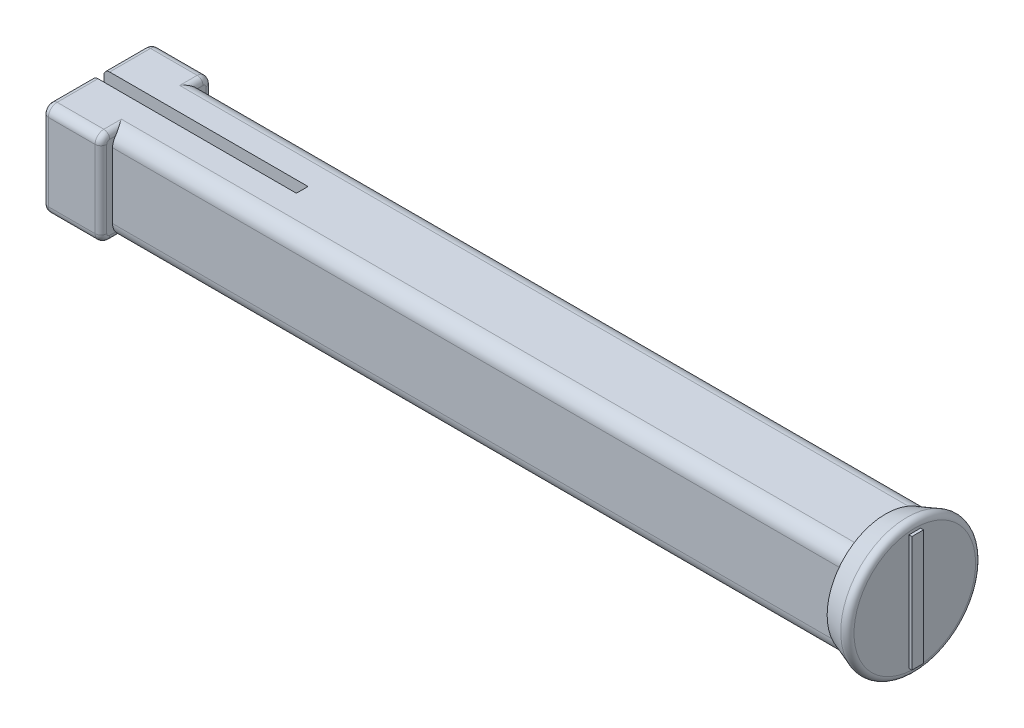
from build123d import *

# Parameters (mm, degrees)
ESQUISSE1_W             = 27
ESQUISSE1_H             = 3.25
BOSS_EXTRU_5_DEPTH      = 3.8
ESQUISSE10_W            = 25
ESQUISSE10_H            = 3.25
ENL_V_MAT_EXTRU_1_DEPTH = 0.4
ESQUISSE12_W            = 25
ESQUISSE12_H            = 3.25
ENL_V_MAT_EXTRU_2_DEPTH = 0.4
ENL_V_MAT_EXTRU_3_DEPTH = 27
ESQUISSE14_W            = 7
ESQUISSE14_H            = 0.4
ENL_V_MAT_EXTRU_4_DEPTH = 21.209927394
CONG_1_R                = 0.5
CONG_2_R                = 0.3
CONG_3_R                = 0.2
ESQUISSE19_R            = 2.005199322
BOSS_EXTRU_8_DEPTH      = 1
D_POUILLE1_ANGLE        = 20
CONG_4_R                = 0.2
ESQUISSE20_W            = 0.4
ESQUISSE20_H            = 3.967080209
BOSS_EXTRU_9_DEPTH      = 0.1


with BuildPart() as part:
    # Esquisse1 → Boss.-Extru.5 (new body)
    with BuildSketch(Plane.XY):
        with Locations((6.081589958, 0.331007393)):
            Rectangle(ESQUISSE1_W, ESQUISSE1_H)
    extrude(amount=BOSS_EXTRU_5_DEPTH)

    # Esquisse10 → Enlèv. mat.-Extru.1 (cut)
    with BuildSketch(Plane(origin=(0, 0, 0), x_dir=(-1, 0, 0), z_dir=(0, 0, -1))):
        with Locations((-7.081589958, 0.331007393)):
            Rectangle(ESQUISSE10_W, ESQUISSE10_H)
    extrude(amount=-ENL_V_MAT_EXTRU_1_DEPTH, mode=Mode.SUBTRACT)

    # Esquisse12 → Enlèv. mat.-Extru.2 (cut)
    with BuildSketch(Plane.XY.offset(3.8)):
        with Locations((7.081589958, 0.331007393)):
            Rectangle(ESQUISSE12_W, ESQUISSE12_H)
    extrude(amount=-ENL_V_MAT_EXTRU_2_DEPTH, mode=Mode.SUBTRACT)

    # Esquisse13 → Enlèv. mat.-Extru.3 (cut)
    with BuildSketch(Plane.ZY.offset(7.418410042)):
        with BuildLine():
            Line((1.3, 1.456007393), (2.5, 1.456007393))
            ThreePointArc((2.5, 1.456007393), (2.853553391, 1.309560783), (3, 0.956007393))
            Line((3, 0.956007393), (3, -0.293992607))
            ThreePointArc((3, -0.293992607), (2.853553391, -0.647545998), (2.5, -0.793992607))
            Line((2.5, -0.793992607), (1.3, -0.793992607))
            ThreePointArc((1.3, -0.793992607), (0.946446609, -0.647545998), (0.8, -0.293992607))
            Line((0.8, -0.293992607), (0.8, 0.956007393))
            ThreePointArc((0.8, 0.956007393), (0.946446609, 1.309560783), (1.3, 1.456007393))
        make_face()
    extrude(amount=-ENL_V_MAT_EXTRU_3_DEPTH, mode=Mode.SUBTRACT)

    # Esquisse14 → Enlèv. mat.-Extru.4 (cut, through all)
    with BuildSketch(Plane(origin=(0, 1.956007393, 0), x_dir=(1, 0, 0), z_dir=(0, 1, 0))):
        with Locations((-3.918410042, -1.9)):
            Rectangle(ESQUISSE14_W, ESQUISSE14_H)
    extrude(amount=-ENL_V_MAT_EXTRU_4_DEPTH, mode=Mode.SUBTRACT)

    # Congé1
    cong_1_edges = [part.edges().sort_by_distance(p)[0] for p in [
        (7.081589958, 1.956007393, 0.4),
        (7.081589958, -1.293992607, 0.4),
        (7.081589958, 1.956007393, 3.4),
        (7.081589958, -1.293992607, 3.4),
    ]]
    fillet(cong_1_edges, radius=CONG_1_R)

    # Congé2
    cong_2_edges = [part.edges().sort_by_distance(p)[0] for p in [
        (-6.418410042, 1.956007393, 0),
        (-6.418410042, 1.956007393, 3.8),
        (-6.418410042, -1.293992607, 0),
        (-6.418410042, -1.293992607, 3.8),
    ]]
    fillet(cong_2_edges, radius=CONG_2_R)

    # Congé3
    cong_3_edges = [part.edges().sort_by_distance(p)[0] for p in [
        (-7.418410042, -1.293992607, 2.8),
        (-5.418410042, 0.331007393, 0),
        (-5.418410042, 1.868139427, 0.087867966),
        (-5.418410042, -1.206124642, 0.087867966),
        (-7.418410042, 0.331007393, 0),
        (-7.418410042, 1.868139427, 0.087867966),
        (-7.418410042, -1.206124642, 0.087867966),
        (-7.418410042, 1.956007393, 2.8),
        (-5.418410042, 0.331007393, 3.8),
        (-7.418410042, 0.331007393, 3.8),
        (-7.418410042, -1.206124642, 3.712132034),
        (-7.418410042, 1.868139427, 3.712132034),
        (-5.418410042, -1.206124642, 3.712132034),
        (-5.418410042, 1.868139427, 3.712132034),
        (-5.418410042, 1.956007393, 0.6),
        (-5.418410042, -1.293992607, 0.6),
        (-5.418410042, -1.293992607, 3.2),
        (-5.418410042, 1.956007393, 3.2),
        (-7.418410042, 1.956007393, 1),
        (-7.418410042, -1.293992607, 1),
    ]]
    fillet(cong_3_edges, radius=CONG_3_R)

    # Esquisse19 → Boss.-Extru.8 (add)
    with BuildSketch(Plane(origin=(19.581589958, 0, 0), x_dir=(0, 0, -1), z_dir=(1, 0, 0))):
        with Locations(Location((-1.9, 0.331007393, 0), (0, 0, 228.366460663))):
            Circle(ESQUISSE19_R)
    extrude(amount=BOSS_EXTRU_8_DEPTH)

    # Dépouille1
    d_pouille1_faces = [part.faces().sort_by_distance(p)[0] for p in [
        (20.081589958, 1.829712052, 0.567818081),
    ]]
    draft(d_pouille1_faces, Plane(origin=(19.581589958, 0.331007393, 1.9), x_dir=(0, 0, -1), z_dir=(-1, 0, 0)), D_POUILLE1_ANGLE)

    # Congé4
    cong_4_edges = [part.edges().sort_by_distance(p)[0] for p in [
        (20.581589958, 2.101746797, 0.326009419),
    ]]
    fillet(cong_4_edges, radius=CONG_4_R)

    # Esquisse20 → Boss.-Extru.9 (add)
    with BuildSketch(Plane(origin=(20.581589958, 0, 0), x_dir=(0, 0, -1), z_dir=(1, 0, 0))):
        with Locations((-1.9, 0.331007542)):
            Rectangle(ESQUISSE20_W, ESQUISSE20_H)
    extrude(amount=BOSS_EXTRU_9_DEPTH)


solid = part.part
